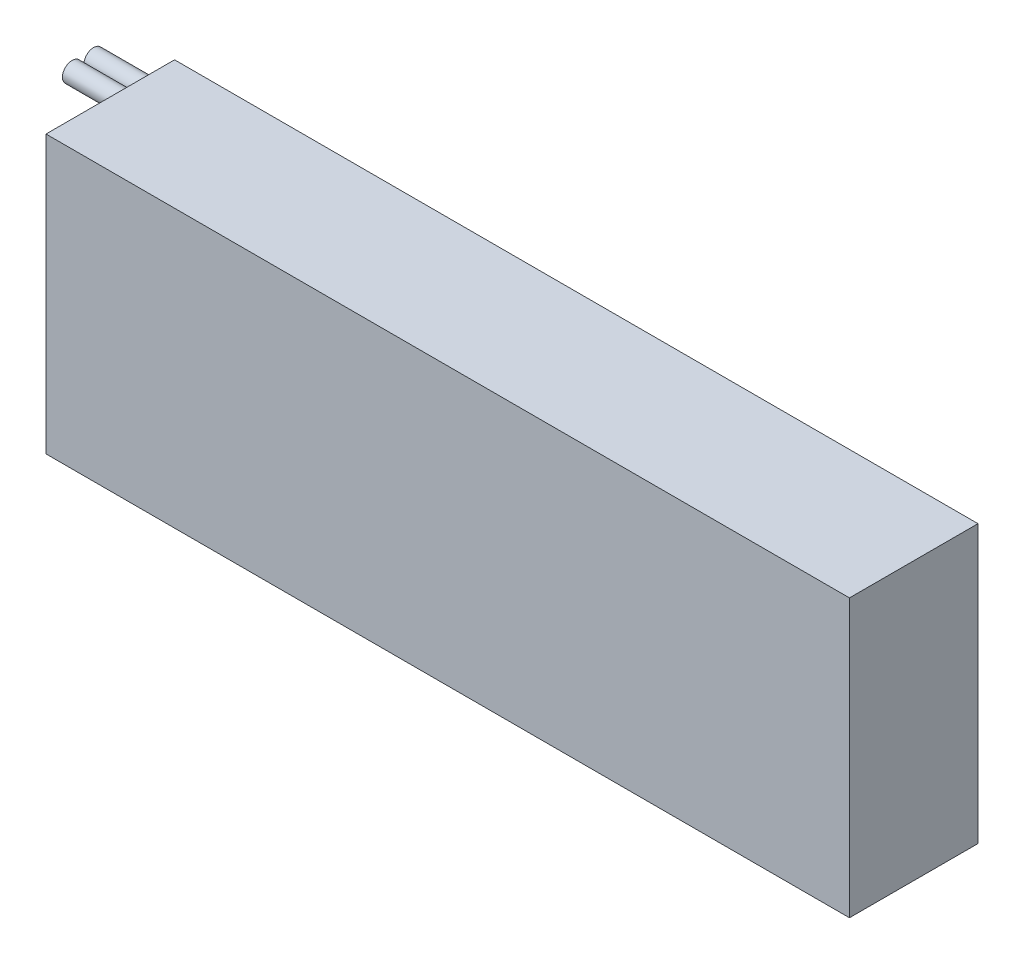
from build123d import *

# Parameters (mm, degrees)
SKETCH1_W           = 145
SKETCH1_H           = 50
BOSS_EXTRUDE1_DEPTH = 23.2
SKETCH2_R           = 1.75
BOSS_EXTRUDE2_DEPTH = 10
SKETCH3_R           = 1.75
BOSS_EXTRUDE3_DEPTH = 10


with BuildPart() as part:
    # Sketch1 → Boss-Extrude1 (new body)
    with BuildSketch(Plane.XY):
        with Locations((-39.629237288, 11.022245763)):
            Rectangle(SKETCH1_W, SKETCH1_H)
    extrude(amount=BOSS_EXTRUDE1_DEPTH)

    # Sketch2 → Boss-Extrude2 (add)
    with BuildSketch(Plane.ZY.offset(112.129237288)):
        with Locations(Location((4.611645571, 33.494222045, 0), (0, 0, 180))):
            Circle(SKETCH2_R)
    extrude(amount=BOSS_EXTRUDE2_DEPTH)

    # Sketch3 → Boss-Extrude3 (add)
    with BuildSketch(Plane.ZY.offset(112.129237288)):
        with Locations(Location((8.487504138, 33.421885549, 0), (0, 0, 180))):
            Circle(SKETCH3_R)
    extrude(amount=BOSS_EXTRUDE3_DEPTH)


solid = part.part
